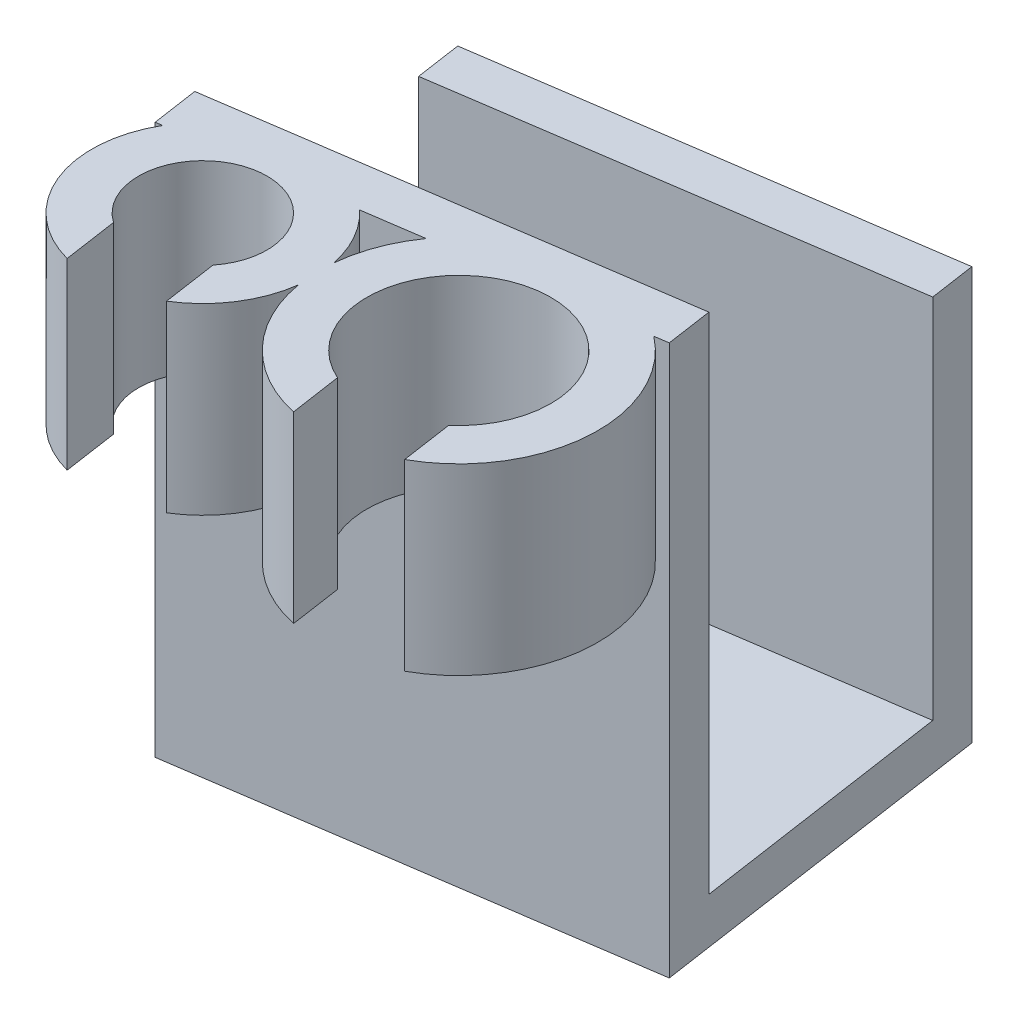
from build123d import *

# Parameters (mm, degrees)
BOSS_EXTRUDE1_DEPTH = 12.7
SKETCH2_R           = 4.445
SKETCH2_R_2         = 6.3754
CUT_EXTRUDE1_DEPTH  = 32.324143561
BOSS_EXTRUDE2_DEPTH = 38.1
SKETCH6_W           = 31.377120578
SKETCH6_H           = 3.175
BOSS_EXTRUDE5_DEPTH = 21.59
BOSS_EXTRUDE6_DEPTH = 25.4
CUT_EXTRUDE3_DEPTH  = 58.023970058


with BuildPart() as part:
    # Sketch1 → Boss-Extrude1 (new body)
    with BuildSketch(Plane(origin=(0, 0, 0), x_dir=(1, 0, 0), z_dir=(0, 1, 0))):
        with BuildLine():
            ThreePointArc((7.527044942, 1.542649246), (-7.678390875, -0.2801532), (7.619451552, -0.990015299))
            ThreePointArc((7.619451552, -0.990015299), (26.729936345, 0.975266474), (7.527044942, 1.542649246))
        make_face()
    extrude(amount=BOSS_EXTRUDE1_DEPTH)

    # Sketch2 → Cut-Extrude1 (cut, through all)
    with BuildSketch(Plane.XZ):
        with Locations(Location((0, 0, 0), (0, 0, 270))):
            Circle(SKETCH2_R)
        with Locations(Location((17.109737529, -0.624264614, 0), (0, 0, 270))):
            Circle(SKETCH2_R_2)
    extrude(amount=-CUT_EXTRUDE1_DEPTH, mode=Mode.SUBTRACT)

    # Sketch3 → Boss-Extrude2 (add)
    with BuildSketch(Plane(origin=(0, 12.7, 0), x_dir=(1, 0, 0), z_dir=(0, 1, 0))):
        Polygon((-7.5722719, 7.013696287), (23.470212778, 11.584018023), (23.943763832, 8.367570213), (-7.098720846, 3.797248478), align=None)
    extrude(amount=-BOSS_EXTRUDE2_DEPTH)

    # Sketch6 → Boss-Extrude5 (add)
    with BuildSketch(Plane(origin=(-1.171358862, 0, -7.956089665), x_dir=(-0.989335034779027, 0, 0.14565778028921603), z_dir=(-0.14565778028921603, 0, -0.989335034779027))):
        with Locations((-9.218645838, -23.8125)):
            Rectangle(SKETCH6_W, SKETCH6_H)
    extrude(amount=BOSS_EXTRUDE5_DEPTH)

    # Sketch7 → Boss-Extrude6 (add)
    with BuildSketch(Plane(origin=(0, -22.225, 0), x_dir=(1, 0, 0), z_dir=(0, 1, 0))):
        Polygon((-10.717023377, 28.373439688), (-10.249574599, 25.198439688), (20.792910079, 29.768761424), (20.325461302, 32.943761424), align=None)
    extrude(amount=BOSS_EXTRUDE6_DEPTH)

    # Sketch8 → Cut-Extrude3 (cut, through all)
    with BuildSketch(Plane(origin=(0, 12.7, 0), x_dir=(1, 0, 0), z_dir=(0, 1, 0))):
        Polygon((-2.52817795, -3.656000718), (3.474592527, -2.772225058), (4.3267986, -8.560568969), (-1.675971877, -9.444344629), align=None)
        Polygon((14.542367287, -5.211344626), (21.250041443, -4.223787434), (21.957699633, -9.030334935), (15.250025476, -10.017892127), align=None)
    extrude(amount=-CUT_EXTRUDE3_DEPTH, mode=Mode.SUBTRACT)


solid = part.part
